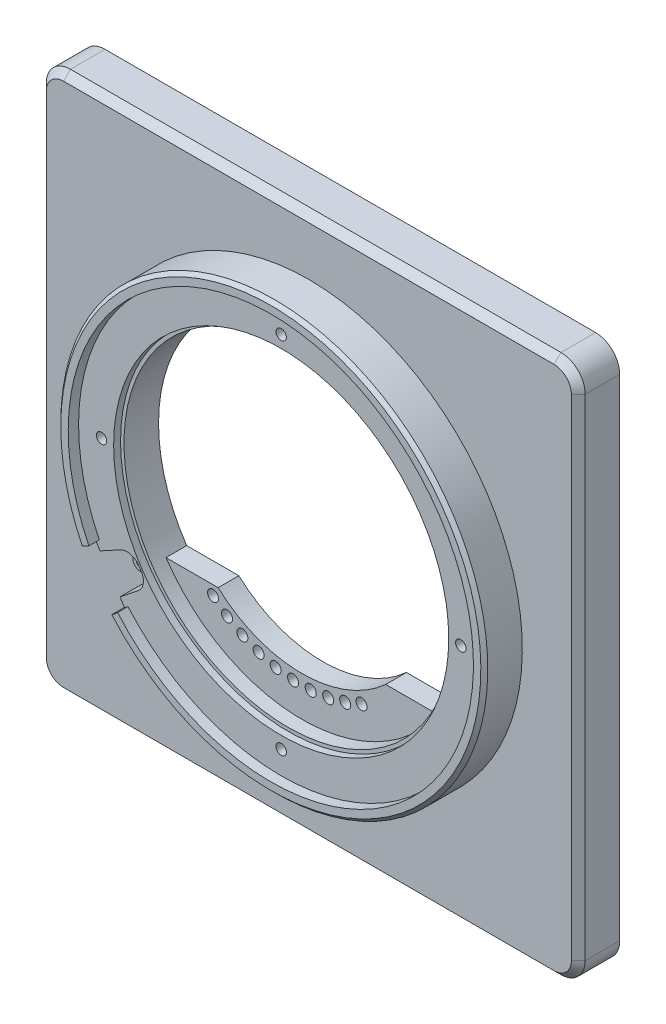
from build123d import *

# Parameters (mm, degrees)
SKETCH_1_W          = 78
SKETCH_1_H          = 78
SKETCH_1_R          = 23.75
EXTRUDE_1_DEPTH     = 2
EXTRUDE_START       = 4
SKETCH_2_R          = 30.9
SKETCH_2_R_2        = 23.75
EXTRUDE_2_DEPTH     = 4
SKETCH_3_W          = 78
SKETCH_3_H          = 78
EXTRUDE_3_DEPTH     = 4
SKETCH_4_R          = 0.75
CUT_EXTRUDE_1_DEPTH = 5
CUT_EXTRUDE_2_DEPTH = 4
SKETCH_6_R          = 1.05
SKETCH_6_R_2        = 0.55
EXTRUDE_4_DEPTH     = 2
EXTRUDE_START_2     = 1.5
EXTRUDE_5_DEPTH     = 1.5
CHAMFER_1_SIZE      = 0.5
SKETCH_9_R          = 1.65
SKETCH_9_R_2        = 0.8
EXTRUDE_6_DEPTH     = 2
CUT_EXTRUDE_START   = -2
SKETCH_9_2_R        = 0.8
CUT_EXTRUDE_4_DEPTH = 2
SKETCH_10_R         = 0.8
CUT_EXTRUDE_5_DEPTH = 4
FILLET_2_R          = 1.5
FILLET_3_R          = 3.5
CHAMFER_2_SIZE      = 1
SKETCH_11_R         = 24.25
CUT_EXTRUDE_6_DEPTH = 1
SKETCH_12_W         = 50
SKETCH_12_H         = 1
SKETCH_12_W_2       = 1
SKETCH_12_H_2       = 50
CUT_EXTRUDE_7_DEPTH = 1
EXTRUDE_START_3     = -3
SKETCH_14_R         = 0.8
EXTRUDE_7_DEPTH     = 3


with BuildPart() as part:
    # 草图1 → 凸台-拉伸1 (new body)
    with BuildSketch(Plane.XY):
        Rectangle(SKETCH_1_W, SKETCH_1_H)
        Circle(SKETCH_1_R, mode=Mode.SUBTRACT)
    extrude(amount=-EXTRUDE_1_DEPTH)

    # 草图2 → 凸台-拉伸2 (add)
    with BuildSketch(Plane.XY.offset(EXTRUDE_START)):
        Circle(SKETCH_2_R)
        Circle(SKETCH_2_R_2, mode=Mode.SUBTRACT)
    extrude(amount=-EXTRUDE_2_DEPTH)

    # 草图3 → 凸台-拉伸3 (add)
    with BuildSketch(Plane(origin=(0, 0, -2), x_dir=(-1, 0, 0), z_dir=(0, 0, -1))):
        Rectangle(SKETCH_3_W, SKETCH_3_H)
        Polygon((32, -37), (-32, -37), (-32, -32), (-37, -32), (-37, 32), (-32, 32), (-32, 37), (32, 37), (32, 32), (37, 32), (37, -32), (32, -32), align=None, mode=Mode.SUBTRACT)
    extrude(amount=EXTRUDE_3_DEPTH)

    # 草图4 → 切除-拉伸1 (cut)
    with BuildSketch(Plane.XY.offset(4)):
        with Locations((0, 26)):
            Circle(SKETCH_4_R)
        with Locations((26, 0)):
            Circle(SKETCH_4_R)
        with Locations((0, -26)):
            Circle(SKETCH_4_R)
        with Locations((-26, 0)):
            Circle(SKETCH_4_R)
    extrude(amount=-CUT_EXTRUDE_1_DEPTH, mode=Mode.SUBTRACT)

    # 草图5 → 切除-拉伸2 (cut)
    with BuildSketch(Plane.XY.offset(4)):
        with BuildLine():
            Line((-27.974819843, -13.719309558), (-23.559323961, -20.390396134))
            Line((-23.559323961, -20.390396134), (-22.644398758, -19.59853609))
            Line((-22.644398758, -19.59853609), (-23.332248508, -18.55930848))
            Line((-23.332248508, -18.55930848), (-20.696942595, -16.463091505))
            ThreePointArc((-20.696942595, -16.463091505), (-19.966595187, -15.210744122), (-20.274200224, -13.794001221))
            Line((-20.274200224, -13.794001221), (-20.619206205, -13.272754043))
            ThreePointArc((-20.619206205, -13.272754043), (-21.803134058, -12.436036561), (-23.24129537, -12.618993788))
            Line((-23.24129537, -12.618993788), (-26.200569323, -14.225748447))
            Line((-26.200569323, -14.225748447), (-26.888419073, -13.186520837))
            Line((-26.888419073, -13.186520837), (-27.974819843, -13.719309558))
        make_face()
    extrude(amount=-CUT_EXTRUDE_2_DEPTH, mode=Mode.SUBTRACT)

    # 草图6 → 凸台-拉伸4 (add)
    with BuildSketch(Plane.XY):
        with Locations((-22.409013696, -14.832202606)):
            Circle(SKETCH_6_R)
        with Locations((-22.409013696, -14.832202606)):
            Circle(SKETCH_6_R_2, mode=Mode.SUBTRACT)
    extrude(amount=EXTRUDE_4_DEPTH)

    # 草图8 → 凸台-拉伸5 (add)
    with BuildSketch(Plane.XY.offset(4).offset(EXTRUDE_START_2)):
        with BuildLine():
            ThreePointArc((30.9, 0), (-6.983586682, 30.100490312), (-27.743334437, -13.605785326))
            Line((-27.743334437, -13.605785326), (-26.888419073, -13.186520837))
            Line((-26.888419073, -13.186520837), (-26.329232439, -12.912286559))
            ThreePointArc((-26.329232439, -12.912286559), (-6.627627167, 28.56624202), (29.325, 0))
            ThreePointArc((29.325, 0), (10.240081174, -27.479016768), (-22.17347315, -19.190953949))
            Line((-22.17347315, -19.190953949), (-22.644398758, -19.59853609))
            Line((-22.644398758, -19.59853609), (-23.3643758, -20.221670146))
            ThreePointArc((-23.3643758, -20.221670146), (10.790059958, -28.954871889), (30.9, 0))
        make_face()
    extrude(amount=-EXTRUDE_5_DEPTH)

    # 倒角1
    chamfer_1_edges = [part.edges().sort_by_distance(p)[0] for p in [
        (25.767071902, 17.054852846, 5.5),
    ]]
    chamfer(chamfer_1_edges, length=CHAMFER_1_SIZE)

    # 草图9 → 凸台-拉伸6 (add)
    # profile 1 of 3: a face of its own
    with BuildSketch(Plane(origin=(0, 0, -2), x_dir=(-1, 0, 0), z_dir=(0, 0, -1))):
        with Locations((-19, -19)):
            Circle(SKETCH_9_R)
        with Locations((-19, -19)):
            Circle(SKETCH_9_R_2, mode=Mode.SUBTRACT)
    # profile 2 of 3: a face of its own
    with BuildSketch(Plane(origin=(0, 0, -2), x_dir=(-1, 0, 0), z_dir=(0, 0, -1))):
        with Locations((-19, 19)):
            Circle(SKETCH_9_R)
        with Locations((-19, 19)):
            Circle(SKETCH_9_R_2, mode=Mode.SUBTRACT)
    # profile 3 of 3: a face of its own
    with BuildSketch(Plane(origin=(0, 0, -2), x_dir=(-1, 0, 0), z_dir=(0, 0, -1))):
        with Locations((19, 19)):
            Circle(SKETCH_9_R)
        with Locations((19, 19)):
            Circle(SKETCH_9_R_2, mode=Mode.SUBTRACT)
    extrude(amount=EXTRUDE_6_DEPTH)

    # 草图9<2> → 切除-拉伸4 (cut)
    with BuildSketch(Plane(origin=(0, 0, -2), x_dir=(-1, 0, 0), z_dir=(0, 0, -1)).offset(CUT_EXTRUDE_START)):
        with Locations((-19, -19)):
            Circle(SKETCH_9_2_R)
        with Locations((-19, 19)):
            Circle(SKETCH_9_2_R)
        with Locations((19, 19)):
            Circle(SKETCH_9_2_R)
    extrude(amount=CUT_EXTRUDE_4_DEPTH, mode=Mode.SUBTRACT)

    # 草图10 → 切除-拉伸5 (cut)
    with BuildSketch(Plane(origin=(0, 0, -6), x_dir=(-1, 0, 0), z_dir=(0, 0, -1))):
        with Locations((-34.5, 34.5)):
            Circle(SKETCH_10_R)
        with Locations((34.5, 34.5)):
            Circle(SKETCH_10_R)
        with Locations((34.5, -34.5)):
            Circle(SKETCH_10_R)
        with Locations((-34.5, -34.5)):
            Circle(SKETCH_10_R)
    extrude(amount=-CUT_EXTRUDE_5_DEPTH, mode=Mode.SUBTRACT)

    # 圆角2
    fillet_2_edges = [part.edges().sort_by_distance(p)[0] for p in [
        (37, -32, -4),
        (32, -37, -4),
        (-32, -37, -4),
        (-32, -32, -4),
        (-37, -32, -4),
        (-37, 32, -4),
        (-32, 37, -4),
        (32, -32, -4),
        (-32, 32, -4),
        (32, 37, -4),
        (37, 32, -4),
        (32, 32, -4),
    ]]
    fillet(fillet_2_edges, radius=FILLET_2_R)

    # 圆角3
    fillet_3_edges = [part.edges().sort_by_distance(p)[0] for p in [
        (39, -39, -3),
        (-39, -39, -3),
        (-39, 39, -3),
        (39, 39, -3),
    ]]
    fillet(fillet_3_edges, radius=FILLET_3_R)

    # 倒角2
    chamfer_2_edges = [part.edges().sort_by_distance(p)[0] for p in [
        (0, -39, 0),
        (37.974873734, -37.974873734, 0),
        (-37.974873734, -37.974873734, 0),
        (39, 0, 0),
        (-39, 0, 0),
        (37.974873734, 37.974873734, 0),
        (-37.974873734, 37.974873734, 0),
        (0, 39, 0),
    ]]
    chamfer(chamfer_2_edges, length=CHAMFER_2_SIZE)

    # 草图11 → 切除-拉伸6 (cut)
    with BuildSketch(Plane.XY.offset(4)):
        Circle(SKETCH_11_R)
    extrude(amount=-CUT_EXTRUDE_6_DEPTH, mode=Mode.SUBTRACT)

    # 草图12 → 切除-拉伸7 (cut)
    with BuildSketch(Plane(origin=(0, 0, -6), x_dir=(-1, 0, 0), z_dir=(0, 0, -1))):
        with Locations((0, 37.5)):
            Rectangle(SKETCH_12_W, SKETCH_12_H)
        with Locations((37.5, 0)):
            Rectangle(SKETCH_12_W_2, SKETCH_12_H_2)
        with Locations((0, -37.5)):
            Rectangle(SKETCH_12_W, SKETCH_12_H)
        with Locations((-37.5, 0)):
            Rectangle(SKETCH_12_W_2, SKETCH_12_H_2)
    extrude(amount=-CUT_EXTRUDE_7_DEPTH, mode=Mode.SUBTRACT)

    # 草图14 → 凸台-拉伸7 (add)
    with BuildSketch(Plane(origin=(0, 0, -2), x_dir=(-1, 0, 0), z_dir=(0, 0, -1)).offset(EXTRUDE_START_3)):
        with BuildLine():
            Line((-12.128891128, -13.3), (-19.676699418, -13.3))
            ThreePointArc((-19.676699418, -13.3), (0, -23.75), (19.676699418, -13.3))
            Line((19.676699418, -13.3), (12.128891128, -13.3))
            ThreePointArc((12.128891128, -13.3), (11.999124031, -13.417191304), (11.868224672, -13.533116535))
            ThreePointArc((11.868224672, -13.533116535), (-0.174850165, -17.999150742), (-12.128891128, -13.3))
        make_face()
        with Locations((-6.268069573, -18.465137525)):
            Circle(SKETCH_14_R, mode=Mode.SUBTRACT)
        with Locations((-3.804261279, -19.125312968)):
            Circle(SKETCH_14_R, mode=Mode.SUBTRACT)
        with Locations((-1.27536102, -19.458249003)):
            Circle(SKETCH_14_R, mode=Mode.SUBTRACT)
        with Locations((-8.624629459, -17.48901846)):
            Circle(SKETCH_14_R, mode=Mode.SUBTRACT)
        with Locations((1.27536102, -19.458249003)):
            Circle(SKETCH_14_R, mode=Mode.SUBTRACT)
        with Locations((3.804261279, -19.125312968)):
            Circle(SKETCH_14_R, mode=Mode.SUBTRACT)
        with Locations((6.268069573, -18.465137525)):
            Circle(SKETCH_14_R, mode=Mode.SUBTRACT)
        with Locations((8.624629459, -17.48901846)):
            Circle(SKETCH_14_R, mode=Mode.SUBTRACT)
        with Locations((10.833619544, -16.21365744)):
            Circle(SKETCH_14_R, mode=Mode.SUBTRACT)
        with BuildLine():
            ThreePointArc((13.657243394, -14.660876246), (12.527077771, -15.389567306), (12.329766742, -14.0594044))
            ThreePointArc((12.329766742, -14.0594044), (13.187409018, -13.932185186), (13.657243394, -14.660876246))
        make_face(mode=Mode.SUBTRACT)
    extrude(amount=EXTRUDE_7_DEPTH)


solid = part.part
